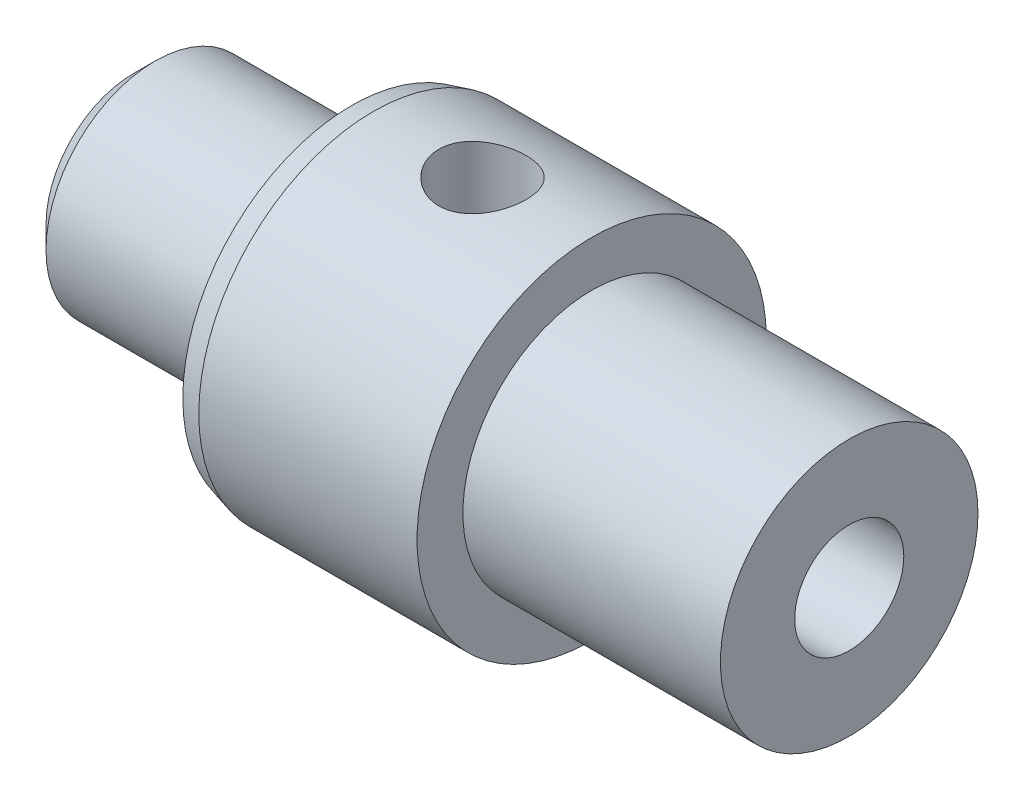
from build123d import *

# Parameters (mm, degrees)
SKETCH1_W                       = 5.5
SKETCH1_H                       = 4
SKETCH2_R                       = 2.5
BOSS_EXTRUDE1_DEPTH             = 5
SKETCH3_R                       = 2.95
BOSS_EXTRUDE2_DEPTH             = 5.9
F_2_0_2_DIAMETER_HOLE1_D        = 2
TAP_DRILL_FOR_M3X0_5_TAP1_D     = 2.5
TAP_DRILL_FOR_M3X0_5_TAP1_DEPTH = 6
TAP_DRILL_FOR_M3X0_5_TAP1_TIP   = 0.751075774
CHAMFER1_SIZE                   = 0.5
CHAMFER2_SIZE                   = 0.133974596
CHAMFER2_SIZE2                  = 0.5


with BuildPart() as part:
    # Sketch1 → Revolve1 (revolve)
    with BuildSketch(Plane.XY, mode=Mode.PRIVATE) as revolve1_sk:
        with Locations((7.75, 2)):
            Rectangle(SKETCH1_W, SKETCH1_H)
    revolve(revolve1_sk.sketch.rotate(Axis((5, 0, 0), (1, 0, 0)), 270), axis=Axis((5, 0, 0), (1, 0, 0)))

    # Sketch2 → Boss-Extrude1 (add)
    with BuildSketch(Plane.ZY.offset(-5)):
        Circle(SKETCH2_R)
    extrude(amount=BOSS_EXTRUDE1_DEPTH)

    # Sketch3 → Boss-Extrude2 (add)
    with BuildSketch(Plane(origin=(10.5, 0, 0), x_dir=(0, 0, -1), z_dir=(1, 0, 0))):
        Circle(SKETCH3_R)
    extrude(amount=BOSS_EXTRUDE2_DEPTH)

    # Ø2.0 (2) Diameter Hole1 (through all)
    with Locations(Plane(origin=(8, -4, 0), x_dir=(0, 0, -1), z_dir=(0, -1, 0))):
        with Locations((0, 0)):
            Hole(F_2_0_2_DIAMETER_HOLE1_D / 2)

    # Tap Drill for M3x0.5 Tap1
    with Locations(Plane(origin=(16.4, 0, 0), x_dir=(0, 0, -1), z_dir=(1, 0, 0))):
        with Locations((0, 0)):
            Hole(TAP_DRILL_FOR_M3X0_5_TAP1_D / 2, depth=TAP_DRILL_FOR_M3X0_5_TAP1_DEPTH)
            with Locations((0, 0, -(TAP_DRILL_FOR_M3X0_5_TAP1_DEPTH + TAP_DRILL_FOR_M3X0_5_TAP1_TIP / 2))):  # 118° drill point
                Cone(0, TAP_DRILL_FOR_M3X0_5_TAP1_D / 2, TAP_DRILL_FOR_M3X0_5_TAP1_TIP, mode=Mode.SUBTRACT)

    # Chamfer1
    chamfer1_edges = [part.edges().sort_by_distance(p)[0] for p in [
        (0, 0, -2.5),
    ]]
    chamfer(chamfer1_edges, length=CHAMFER1_SIZE)

    # Chamfer2
    chamfer2_edges = [part.edges().sort_by_distance(p)[0] for p in [
        (5, 0, 4),
    ]]
    chamfer2_side = [part.faces().sort_by_distance(p)[0] for p in [
        (5, 0, 3.886862915),
    ]]
    chamfer(chamfer2_edges, length=CHAMFER2_SIZE, length2=CHAMFER2_SIZE2, reference=chamfer2_side[0])


solid = part.part
